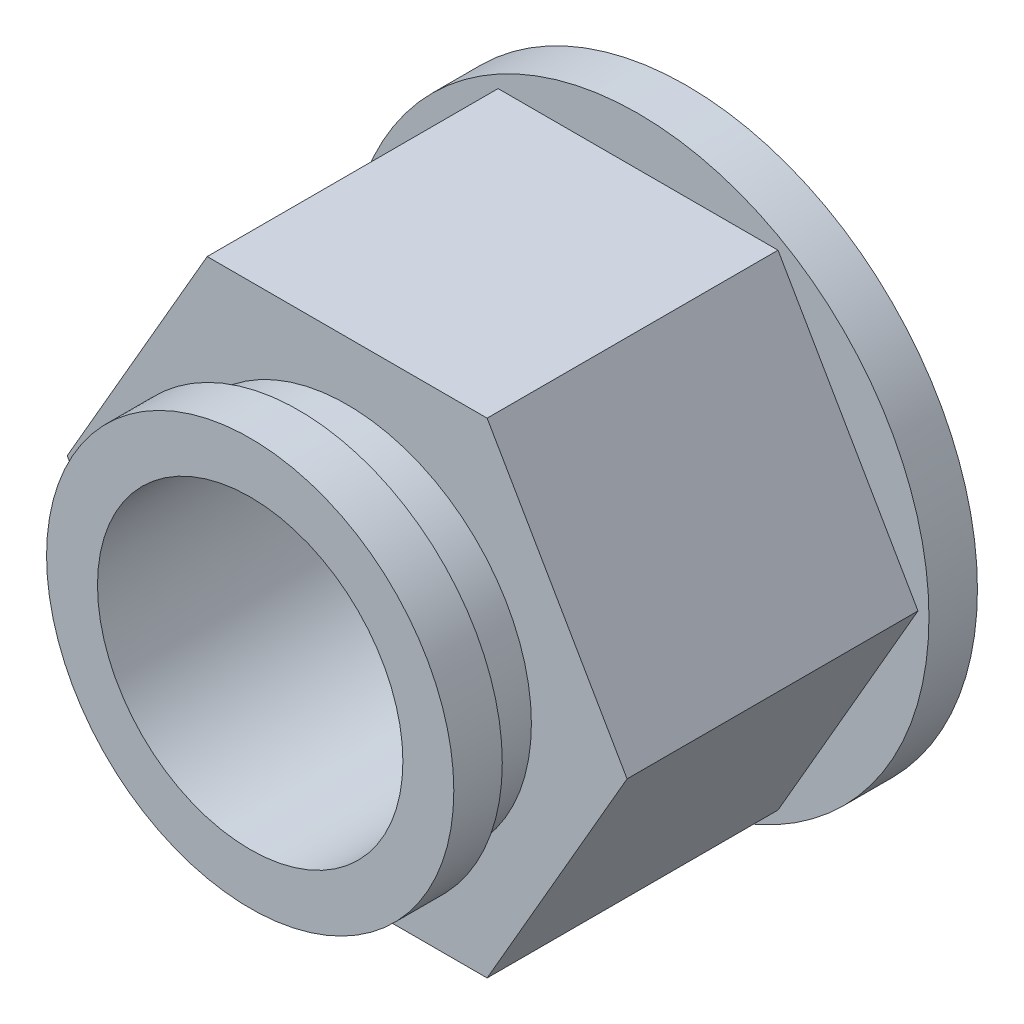
from build123d import *

# Parameters (mm, degrees)
BOSS_EXTRU_1_DEPTH      = 3.81
ESQUISSE2_R             = 7.62
BOSS_EXTRU_2_DEPTH      = 1.27
ESQUISSE3_R             = 4.826
BOSS_EXTRU_3_DEPTH      = 1.27
ESQUISSE4_R             = 5.334
BOSS_EXTRU_4_DEPTH      = 1.27
ESQUISSE5_R             = 4
ENL_V_MAT_EXTRU_1_DEPTH = 16.709032434


with BuildPart() as part:
    # Esquisse1 → Boss.-Extru.1 (new, symmetric)
    with BuildSketch(Plane.XY):
        Polygon((7.332348419, 0), (3.666174209, 6.35), (-3.666174209, 6.35), (-7.332348419, 0), (-3.666174209, -6.35), (3.666174209, -6.35), align=None)
    extrude(amount=BOSS_EXTRU_1_DEPTH, both=True)

    # Esquisse2 → Boss.-Extru.2 (add)
    with BuildSketch(Plane(origin=(0, 0, -3.81), x_dir=(-1, 0, 0), z_dir=(0, 0, -1))):
        Circle(ESQUISSE2_R)
    extrude(amount=BOSS_EXTRU_2_DEPTH)

    # Esquisse3 → Boss.-Extru.3 (add)
    with BuildSketch(Plane.XY.offset(3.81)):
        Circle(ESQUISSE3_R)
    extrude(amount=BOSS_EXTRU_3_DEPTH)

    # Esquisse4 → Boss.-Extru.4 (add)
    with BuildSketch(Plane.XY.offset(5.08)):
        Circle(ESQUISSE4_R)
    extrude(amount=BOSS_EXTRU_4_DEPTH)

    # Esquisse5 → Enlèv. mat.-Extru.1 (cut, through all)
    with BuildSketch(Plane(origin=(0, 0, -5.08), x_dir=(-1, 0, 0), z_dir=(0, 0, -1))):
        Circle(ESQUISSE5_R)
    extrude(amount=-ENL_V_MAT_EXTRU_1_DEPTH, mode=Mode.SUBTRACT)


solid = part.part
